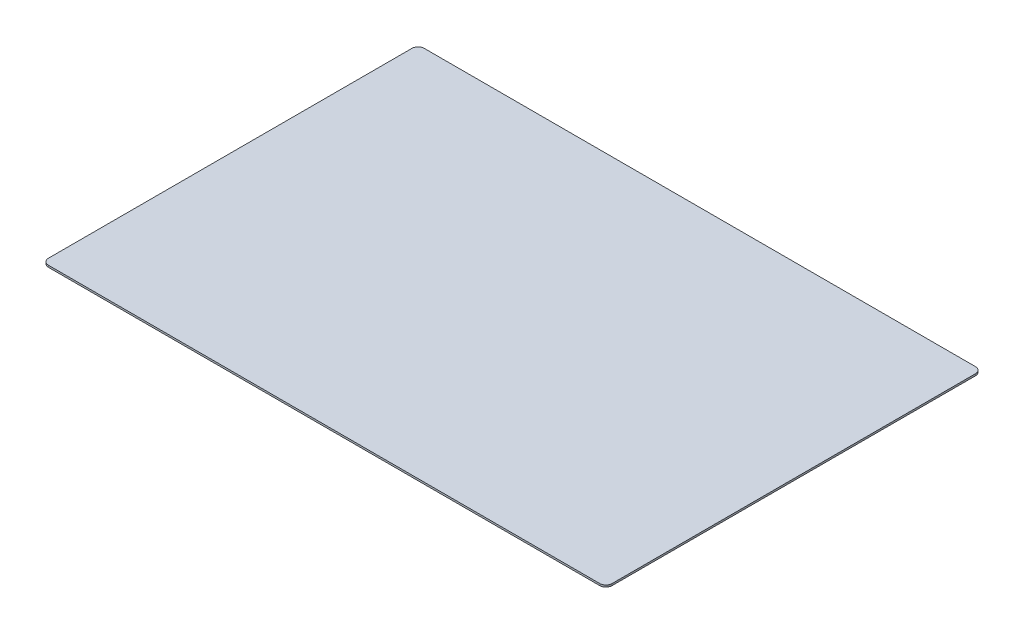
from build123d import *

# Parameters (mm, degrees)
SKETCH1_W           = 914.4
SKETCH1_H           = 609.6
BOSS_EXTRUDE1_DEPTH = 3
FILLET1_R           = 10


with BuildPart() as part:
    # Sketch1 → Boss-Extrude1 (new body)
    with BuildSketch(Plane(origin=(0, 0, 0), x_dir=(1, 0, 0), z_dir=(0, 1, 0))):
        Rectangle(SKETCH1_W, SKETCH1_H)
    extrude(amount=BOSS_EXTRUDE1_DEPTH)

    # Fillet1
    fillet1_edges = [part.edges().sort_by_distance(p)[0] for p in [
        (457.2, 1.5, 304.8),
        (-457.2, 1.5, 304.8),
        (-457.2, 1.5, -304.8),
        (457.2, 1.5, -304.8),
    ]]
    fillet(fillet1_edges, radius=FILLET1_R)


solid = part.part
